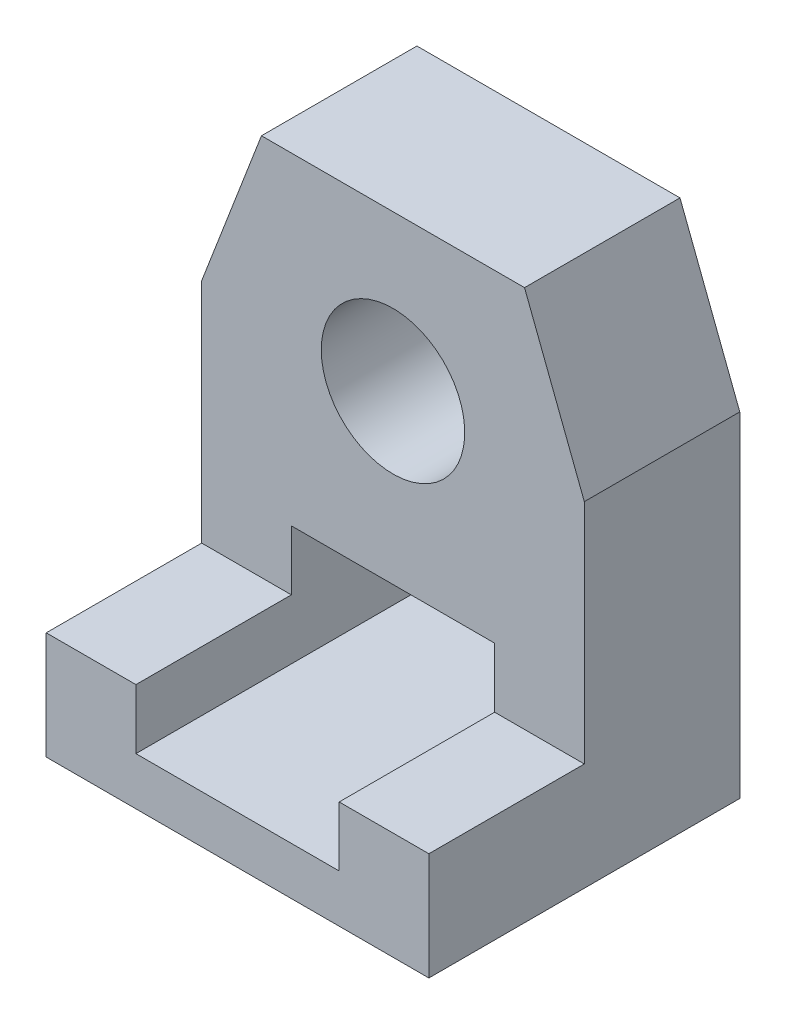
from build123d import *

# Parameters (mm, degrees)
SKETCH_1_R      = 6
SKETCH_1_W      = 17
SKETCH_1_H      = 10
EXTRUDE_1_DEPTH = 13
EXTRUDE_2_DEPTH = 13


with BuildPart() as part:
    # 草图1 → 凸台-拉伸1 (new body)
    with BuildSketch(Plane.XY):
        Polygon((-11, 13), (11, 13), (16, 0), (16, -28), (-16, -28), (-16, 0), align=None)
        with Locations(Location((0, 0, 0), (0, 0, 180))):
            Circle(SKETCH_1_R, mode=Mode.SUBTRACT)
        with Locations((0, -19)):
            Rectangle(SKETCH_1_W, SKETCH_1_H, mode=Mode.SUBTRACT)
    extrude(amount=EXTRUDE_1_DEPTH)

    # 草图2 → 凸台-拉伸2 (add)
    with BuildSketch(Plane.XY.offset(13)):
        Polygon((-8.5, -19), (-16, -19), (-16, -28), (16, -28), (16, -19), (8.5, -19), (8.5, -24), (-8.5, -24), align=None)
    extrude(amount=EXTRUDE_2_DEPTH)


solid = part.part
